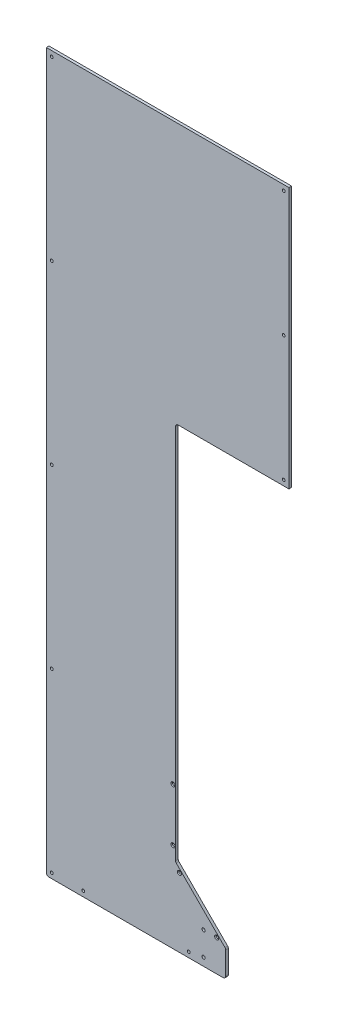
from build123d import *

# Parameters (mm, degrees)
SKETCH2_W                                          = 584.2
SKETCH2_H                                          = 1727.2
BOSS_EXTRUDE1_DEPTH                                = 6.35
CUT_EXTRUDE1_DEPTH                                 = 1824.334802635
H_0_266_DIAMETER_HOLE1_D                           = 6.7564
FILLET1_R                                          = 6.35
SKETCH7_R                                          = 3.3782
CUT_EXTRUDE2_DEPTH                                 = 12.7
CSK_FOR_10_FLAT_HEAD_MACHINE_SCREW_100_D           = 5.6134
CSK_FOR_10_FLAT_HEAD_MACHINE_SCREW_100_CSINK_D     = 9.779
CSK_FOR_10_FLAT_HEAD_MACHINE_SCREW_100_CSINK_ANGLE = 100
SKETCH13_R                                         = 3.937
CUT_EXTRUDE3_DEPTH                                 = 1824.334802635


with BuildPart() as part:
    # Sketch2 → Boss-Extrude1 (new body)
    with BuildSketch(Plane.XY):
        with Locations((292.1, 863.6)):
            Rectangle(SKETCH2_W, SKETCH2_H)
    extrude(amount=BOSS_EXTRUDE1_DEPTH)

    # Sketch3 → Cut-Extrude1 (cut, through all)
    with BuildSketch(Plane.XY.offset(6.35)):
        Polygon((584.2, 1098.55), (311.15, 1098.55), (311.15, 184.15), (431.8, 63.5), (431.8, 0), (584.2, 0), align=None)
    extrude(amount=-CUT_EXTRUDE1_DEPTH, mode=Mode.SUBTRACT)

    # H (0.266) Diameter Hole1 (through all)
    with Locations(Plane.XY.offset(6.35)):
        with Locations((12.7, 1714.5), (12.7, 1289.05), (12.7, 863.6), (12.7, 438.15), (12.7, 12.7), (571.5, 1111.25), (571.5, 1412.875), (571.5, 1714.5)):
            Hole(H_0_266_DIAMETER_HOLE1_D / 2)

    # Fillet1
    fillet1_edges = [part.edges().sort_by_distance(p)[0] for p in [
        (431.8, 0, 3.175),
        (431.8, 63.5, 3.175),
        (311.15, 184.15, 3.175),
        (311.15, 1098.55, 3.175),
        (0, 0, 3.175),
    ]]
    fillet(fillet1_edges, radius=FILLET1_R)

    # Sketch7 → Cut-Extrude2 (cut)
    with BuildSketch(Plane.XY.offset(6.35)):
        with Locations((88.9, 12.7)):
            Circle(SKETCH7_R)
        with Locations((342.9, 12.7)):
            Circle(SKETCH7_R)
    extrude(amount=-CUT_EXTRUDE2_DEPTH, mode=Mode.SUBTRACT)

    # CSK for #10 Flat Head Machine Screw (100)1 (through all)
    with Locations(Plane.XY.offset(6.35)):
        with Locations((304.8, 342.9), (304.8, 215.9), (320.317182668, 166.002561211), (410.119743879, 76.2)):
            CounterSinkHole(CSK_FOR_10_FLAT_HEAD_MACHINE_SCREW_100_D / 2, CSK_FOR_10_FLAT_HEAD_MACHINE_SCREW_100_CSINK_D / 2, counter_sink_angle=CSK_FOR_10_FLAT_HEAD_MACHINE_SCREW_100_CSINK_ANGLE)

    # Sketch13 → Cut-Extrude3 (cut, through all)
    with BuildSketch(Plane(origin=(0, 0, 0), x_dir=(-1, 0, 0), z_dir=(0, 0, -1))):
        with Locations((-378.46762, 76.2)):
            Circle(SKETCH13_R)
        with Locations((-378.46762, 19.05)):
            Circle(SKETCH13_R)
    extrude(amount=-CUT_EXTRUDE3_DEPTH, mode=Mode.SUBTRACT)


solid = part.part
